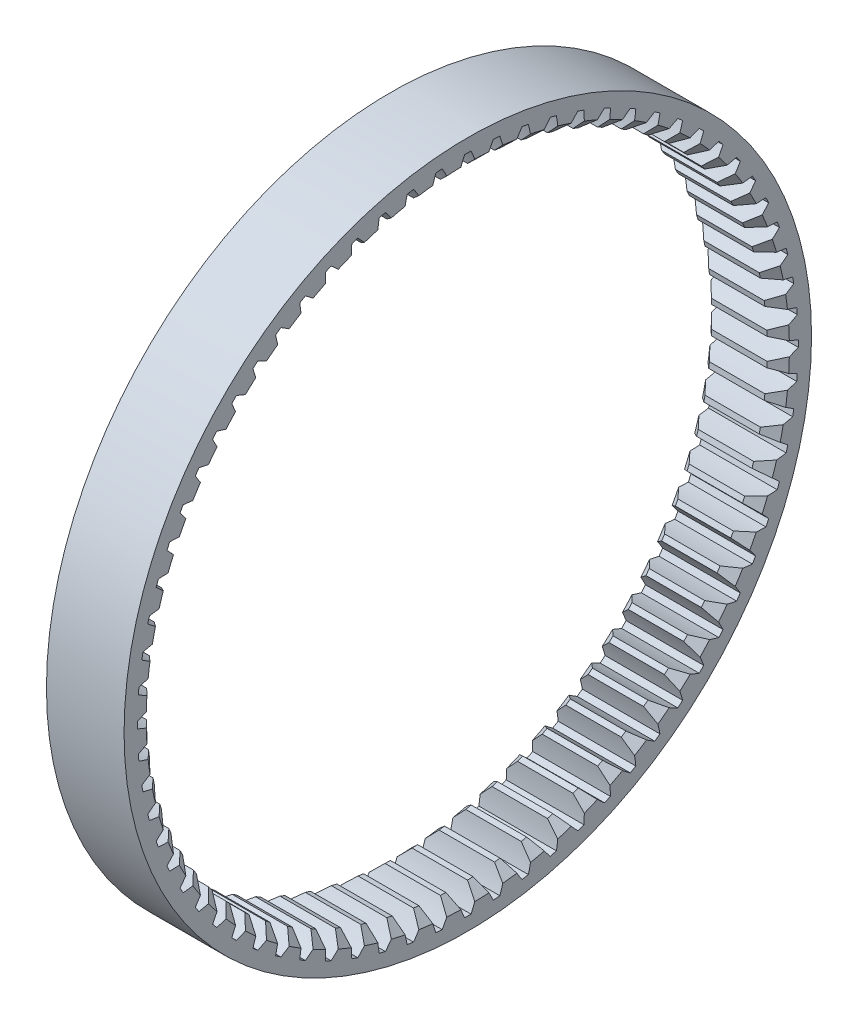
from build123d import *

# Parameters (mm, degrees)
BASPROSKE_W     = 7
BASPROSKE_H     = 3
TOOTHCUT_DEPTH  = 45.395945761
TEETHCUTS_COUNT = 72
TEETHCUTS_ANGLE = 355


with BuildPart() as part:
    # BasProSke → Base-Revolve (revolve)
    with BuildSketch(Plane(origin=(0, 0, 0), x_dir=(1, 0, 0), z_dir=(0, 1, 0)), mode=Mode.PRIVATE) as base_revolve_sk:
        with Locations((3.5, 29.5)):
            Rectangle(BASPROSKE_W, BASPROSKE_H)
    revolve(base_revolve_sk.sketch.rotate(Axis((-10, 0, 0), (1, 0, 0)), 180), axis=Axis((-10, 0, 0), (1, 0, 0)))

    # TooCutSke → ToothCut (cut, through all)
    with BuildSketch(Plane(origin=(0, 0, 0), x_dir=(0, 0, -1), z_dir=(1, 0, 0))):
        with BuildLine():
            ThreePointArc((0.981426823, 27.957379107), (0.666469424, 28.890344343), (0.288488112, 29.799603615))
            ThreePointArc((0.288488112, 29.799603615), (0, 29.801), (-0.288488112, 29.799603615))
            ThreePointArc((-0.288488112, 29.799603615), (-0.666469424, 28.890344343), (-0.981426823, 27.957379107))
            ThreePointArc((-0.981426823, 27.957379107), (0, 27.9746), (0.981426823, 27.957379107))
        make_face()
    toothcut = extrude(amount=TOOTHCUT_DEPTH, mode=Mode.SUBTRACT)

    # TeethCuts: ToothCut ×72 about axis
    teethcuts_axis = Axis((-10, 0, 0), (1, 0, 0))
    for i in range(1, TEETHCUTS_COUNT):
        add(toothcut.rotate(teethcuts_axis, i * TEETHCUTS_ANGLE / (TEETHCUTS_COUNT - 1)), mode=Mode.SUBTRACT)

    # Szkic1 → Wycięcie-obrót1 (revolve, cut)
    with BuildSketch(Plane(origin=(0, 0, 0), x_dir=(1, 0, 0), z_dir=(0, 1, 0))):
        Polygon((0, -29), (0, -28), (1, -28), align=None)
    wyci_cie_obr_t1 = revolve(axis=Axis((7, 0, 0), (-1, 0, 0)), mode=Mode.SUBTRACT)

    # Lustro1: Wycięcie-obrót1 across plane
    add(wyci_cie_obr_t1.mirror(Plane.ZY.offset(-3.5)), mode=Mode.SUBTRACT)


solid = part.part
